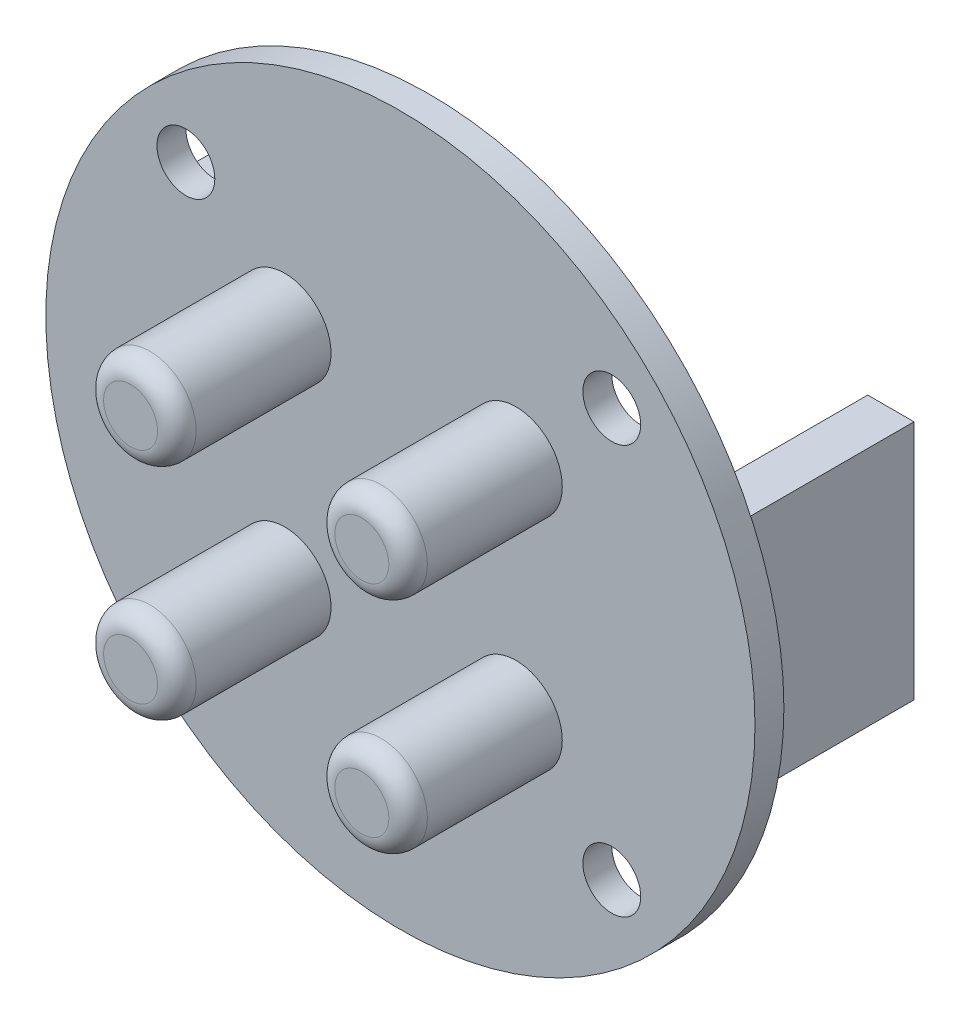
from build123d import *

# Parameters (mm, degrees)
ESQUISSE1_R             = 18.4
BOSS_EXTRU_1_DEPTH      = 1.5
ESQUISSE3_R             = 1.5
ENL_V_MAT_EXTRU_1_DEPTH = 10
ESQUISSE4_W             = 2.4
ESQUISSE4_H             = 12.5
BOSS_EXTRU_2_DEPTH      = 10
ESQUISSE5_R             = 2.4
BOSS_EXTRU_3_DEPTH      = 8
CONG_1_R                = 1


with BuildPart() as part:
    # Esquisse1 → Boss.-Extru.1 (new body)
    with BuildSketch(Plane.XY):
        Circle(ESQUISSE1_R)
    extrude(amount=BOSS_EXTRU_1_DEPTH)

    # Esquisse3 → Enlèv. mat.-Extru.1 (cut)
    with BuildSketch(Plane(origin=(0, 0, 0), x_dir=(-1, 0, 0), z_dir=(0, 0, -1))):
        with Locations((28.033142688, 46.078269557)):
            Circle(ESQUISSE3_R)
        with Locations((28.033142688, 24.878269557)):
            Circle(ESQUISSE3_R)
        with Locations((5.933142688, 24.878269557)):
            Circle(ESQUISSE3_R)
        with Locations((5.933142688, 46.078269557)):
            Circle(ESQUISSE3_R)
        with Locations((11.130946107, 10.522350341)):
            Circle(ESQUISSE3_R)
        with Locations((11.130946107, -10.677649659)):
            Circle(ESQUISSE3_R)
        with Locations((-10.969053893, -10.677649659)):
            Circle(ESQUISSE3_R)
        with Locations((-10.969053893, 10.522350341)):
            Circle(ESQUISSE3_R)
    extrude(amount=-ENL_V_MAT_EXTRU_1_DEPTH, mode=Mode.SUBTRACT)

    # Esquisse4 → Boss.-Extru.2 (add)
    with BuildSketch(Plane(origin=(0, 0, 0), x_dir=(-1, 0, 0), z_dir=(0, 0, -1))):
        with Locations((13.95, 0)):
            Rectangle(ESQUISSE4_W, ESQUISSE4_H)
        with Locations((-13.95, 0)):
            Rectangle(ESQUISSE4_W, ESQUISSE4_H)
    extrude(amount=BOSS_EXTRU_2_DEPTH)

    # Esquisse5 → Boss.-Extru.3 (add)
    with BuildSketch(Plane.XY.offset(1.5)):
        with Locations((6, 5.7)):
            Circle(ESQUISSE5_R)
        with Locations((6, -5.7)):
            Circle(ESQUISSE5_R)
        with Locations((-6, -5.7)):
            Circle(ESQUISSE5_R)
        with Locations((-6, 5.7)):
            Circle(ESQUISSE5_R)
    extrude(amount=BOSS_EXTRU_3_DEPTH)

    # Congé1
    cong_1_edges = [part.edges().sort_by_distance(p)[0] for p in [
        (3.6, 5.7, 9.5),
        (3.6, -5.7, 9.5),
        (-8.4, -5.7, 9.5),
        (-8.4, 5.7, 9.5),
    ]]
    fillet(cong_1_edges, radius=CONG_1_R)


solid = part.part
